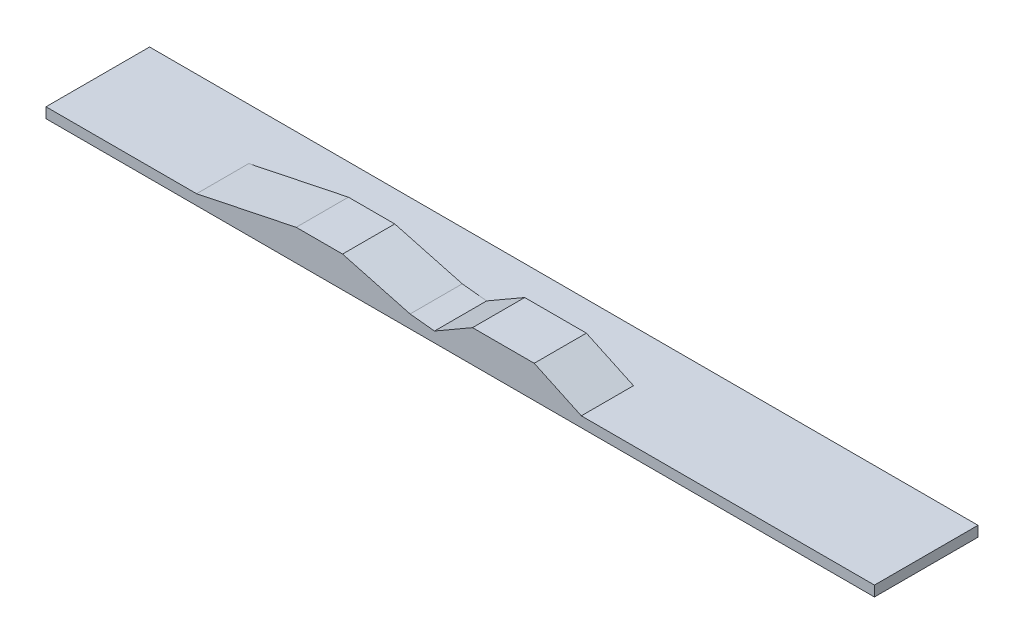
from build123d import *

# Parameters (mm, degrees)
SKETCH1_W           = 8000
SKETCH1_H           = 1000
BOSS_EXTRUDE1_DEPTH = 100
BOSS_EXTRUDE2_DEPTH = 504


with BuildPart() as part:
    # Sketch1 → Boss-Extrude1 (new body)
    with BuildSketch(Plane(origin=(0, 0, 0), x_dir=(1, 0, 0), z_dir=(0, 1, 0))):
        Rectangle(SKETCH1_W, SKETCH1_H)
    extrude(amount=BOSS_EXTRUDE1_DEPTH)

    # Sketch2 → Boss-Extrude2 (add)
    with BuildSketch(Plane.XY.offset(500)):
        Polygon((1169.324917581, 100), (714.418726972, 312.126240423), (118.620890376, 312.126240423), (-248.792535656, 100), (-483.880856043, 125.224318456), (-1136.152579494, 300), (-1583.979143674, 300), (-2545.976948209, 100), (-2545.976948209, 0), (2172.788144725, 0), (2172.788144725, 100), align=None)
    extrude(amount=-BOSS_EXTRUDE2_DEPTH)


solid = part.part
